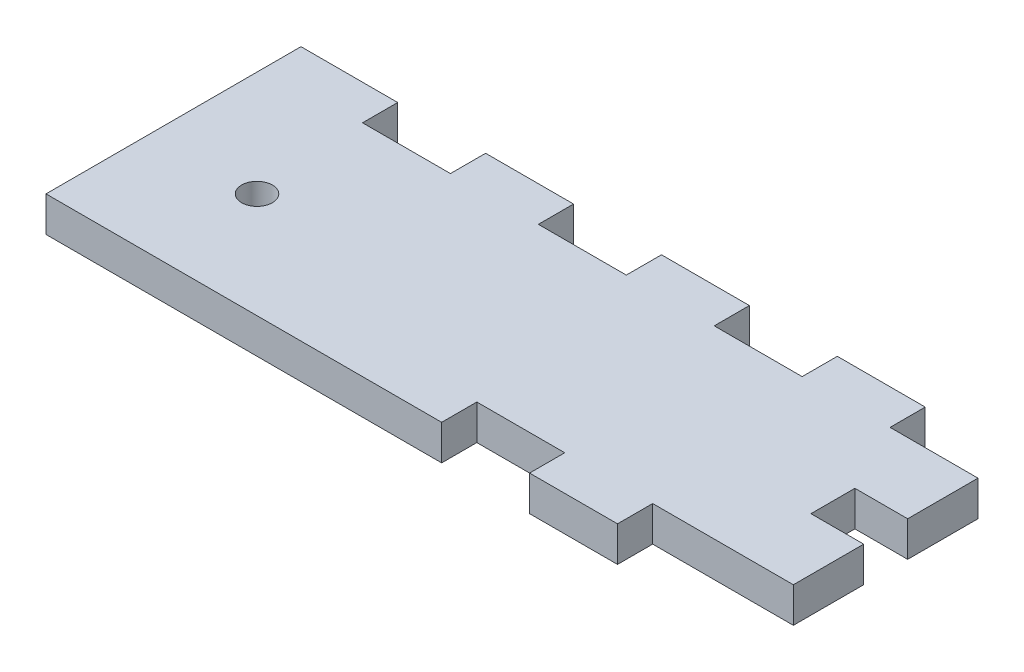
from build123d import *

# Parameters (mm, degrees)
SKETCH1_W           = 75
SKETCH1_H           = 21
BOSS_EXTRUDE1_DEPTH = 4
SKETCH2_W           = 8
SKETCH2_H           = 4
BOSS_EXTRUDE2_DEPTH = 6
SKETCH3_W           = 10
SKETCH3_H           = 4
BOSS_EXTRUDE3_DEPTH = 4
LPATTERN1_COUNT     = 4
LPATTERN1_PITCH     = 20
SKETCH4_W           = 1
SKETCH4_H           = 4
BOSS_EXTRUDE4_DEPTH = 4
SKETCH5_W           = 45
SKETCH5_H           = 4
SKETCH5_W_2         = 10
BOSS_EXTRUDE5_DEPTH = 4
SKETCH6_R           = 1.75
CUT_EXTRUDE1_DEPTH  = 85.864598037


with BuildPart() as part:
    # Sketch1 → Boss-Extrude1 (new body)
    with BuildSketch(Plane(origin=(0, 0, 0), x_dir=(1, 0, 0), z_dir=(0, 1, 0))):
        with Locations((37.5, -10.5)):
            Rectangle(SKETCH1_W, SKETCH1_H)
    extrude(amount=BOSS_EXTRUDE1_DEPTH)

    # Sketch2 → Boss-Extrude2 (add)
    with BuildSketch(Plane(origin=(75, 0, 0), x_dir=(0, 0, -1), z_dir=(1, 0, 0))):
        with Locations((-17, 2)):
            Rectangle(SKETCH2_W, SKETCH2_H)
        with Locations((-4, 2)):
            Rectangle(SKETCH2_W, SKETCH2_H)
    extrude(amount=BOSS_EXTRUDE2_DEPTH)

    # Sketch3 → Boss-Extrude3 (add, through all)
    with BuildSketch(Plane(origin=(0, 4, 0), x_dir=(1, 0, 0), z_dir=(0, 1, 0))):
        with Locations((66, 2)):
            Rectangle(SKETCH3_W, SKETCH3_H)
    boss_extrude3 = extrude(amount=-BOSS_EXTRUDE3_DEPTH)

    # LPattern1: Boss-Extrude3 ×4
    with Locations(*[(-i * LPATTERN1_PITCH, 0, 0) for i in range(1, LPATTERN1_COUNT)]):
        add(boss_extrude3)

    # Sketch4 → Boss-Extrude4 (add, through all)
    with BuildSketch(Plane(origin=(0, 4, 0), x_dir=(1, 0, 0), z_dir=(0, 1, 0))):
        with Locations((0.5, 2)):
            Rectangle(SKETCH4_W, SKETCH4_H)
    extrude(amount=-BOSS_EXTRUDE4_DEPTH)

    # Sketch5 → Boss-Extrude5 (add, through all)
    with BuildSketch(Plane(origin=(0, 4, 0), x_dir=(1, 0, 0), z_dir=(0, 1, 0))):
        with Locations((22.5, -23)):
            Rectangle(SKETCH5_W, SKETCH5_H)
        with Locations((60, -23)):
            Rectangle(SKETCH5_W_2, SKETCH5_H)
    extrude(amount=-BOSS_EXTRUDE5_DEPTH)

    # Sketch6 → Cut-Extrude1 (cut, through all)
    with BuildSketch(Plane(origin=(0, 4, 0), x_dir=(1, 0, 0), z_dir=(0, 1, 0))):
        with Locations(Location((12, -13, 0), (0, 0, 270))):
            Circle(SKETCH6_R)
    extrude(amount=-CUT_EXTRUDE1_DEPTH, mode=Mode.SUBTRACT)


solid = part.part
